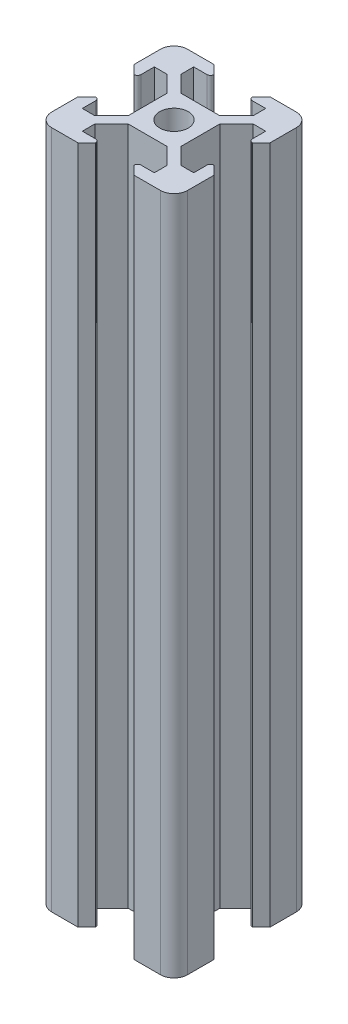
from build123d import *

# Parameters (mm, degrees)
CROQUIS1_R              = 2.1
SALIENTE_EXTRUIR2_DEPTH = 100


with BuildPart() as part:
    # Croquis1 → Saliente-Extruir2 (new body)
    with BuildSketch(Plane(origin=(0, 0, 0), x_dir=(1, 0, 0), z_dir=(0, 1, 0))):
        with BuildLine():
            Line((3.9, -2.84), (3.9, 2.84))
            Line((3.9, 2.84), (6.36, 5.3))
            Line((6.36, 5.3), (8.2, 5.3))
            Line((8.2, 5.3), (8.2, 3.34))
            ThreePointArc((8.2, 3.34), (8.346446609, 2.986446609), (8.7, 2.84))
            Line((8.7, 2.84), (10, 4.14))
            Line((10, 4.14), (10, 8))
            ThreePointArc((10, 8), (9.414213562, 9.414213562), (8, 10))
            Line((8, 10), (4.14, 10))
            Line((4.14, 10), (2.84, 8.7))
            ThreePointArc((2.84, 8.7), (2.986446609, 8.346446609), (3.34, 8.2))
            Line((3.34, 8.2), (5.3, 8.2))
            Line((5.3, 8.2), (5.3, 6.36))
            Line((5.3, 6.36), (2.84, 3.9))
            Line((2.84, 3.9), (-2.84, 3.9))
            Line((-2.84, 3.9), (-5.3, 6.36))
            Line((-5.3, 6.36), (-5.3, 8.2))
            Line((-5.3, 8.2), (-3.34, 8.2))
            ThreePointArc((-3.34, 8.2), (-2.986446609, 8.346446609), (-2.84, 8.7))
            Line((-2.84, 8.7), (-4.14, 10))
            Line((-4.14, 10), (-8, 10))
            ThreePointArc((-8, 10), (-9.414213562, 9.414213562), (-10, 8))
            Line((-10, 8), (-10, 4.14))
            Line((-10, 4.14), (-8.7, 2.84))
            ThreePointArc((-8.7, 2.84), (-8.346446609, 2.986446609), (-8.2, 3.34))
            Line((-8.2, 3.34), (-8.2, 5.3))
            Line((-8.2, 5.3), (-6.36, 5.3))
            Line((-6.36, 5.3), (-3.9, 2.84))
            Line((-3.9, 2.84), (-3.9, -2.84))
            Line((-3.9, -2.84), (-6.36, -5.3))
            Line((-6.36, -5.3), (-8.2, -5.3))
            Line((-8.2, -5.3), (-8.2, -3.34))
            ThreePointArc((-8.2, -3.34), (-8.346446609, -2.986446609), (-8.7, -2.84))
            Line((-8.7, -2.84), (-10, -4.14))
            Line((-10, -4.14), (-10, -8))
            ThreePointArc((-10, -8), (-9.414213562, -9.414213562), (-8, -10))
            Line((-8, -10), (-4.14, -10))
            Line((-4.14, -10), (-2.84, -8.7))
            ThreePointArc((-2.84, -8.7), (-2.986446609, -8.346446609), (-3.34, -8.2))
            Line((-3.34, -8.2), (-5.3, -8.2))
            Line((-5.3, -8.2), (-5.3, -6.36))
            Line((-5.3, -6.36), (-2.84, -3.9))
            Line((-2.84, -3.9), (2.84, -3.9))
            Line((2.84, -3.9), (5.3, -6.36))
            Line((5.3, -6.36), (5.3, -8.2))
            Line((5.3, -8.2), (3.34, -8.2))
            ThreePointArc((3.34, -8.2), (2.986446609, -8.346446609), (2.84, -8.7))
            Line((2.84, -8.7), (4.14, -10))
            Line((4.14, -10), (8, -10))
            ThreePointArc((8, -10), (9.414213562, -9.414213562), (10, -8))
            Line((10, -8), (10, -4.14))
            Line((10, -4.14), (8.7, -2.84))
            ThreePointArc((8.7, -2.84), (8.346446609, -2.986446609), (8.2, -3.34))
            Line((8.2, -3.34), (8.2, -5.3))
            Line((8.2, -5.3), (6.36, -5.3))
            Line((6.36, -5.3), (3.9, -2.84))
        make_face()
        with Locations(Location((0, 0, 0), (0, 0, 270))):
            Circle(CROQUIS1_R, mode=Mode.SUBTRACT)
    extrude(amount=SALIENTE_EXTRUIR2_DEPTH)


solid = part.part
